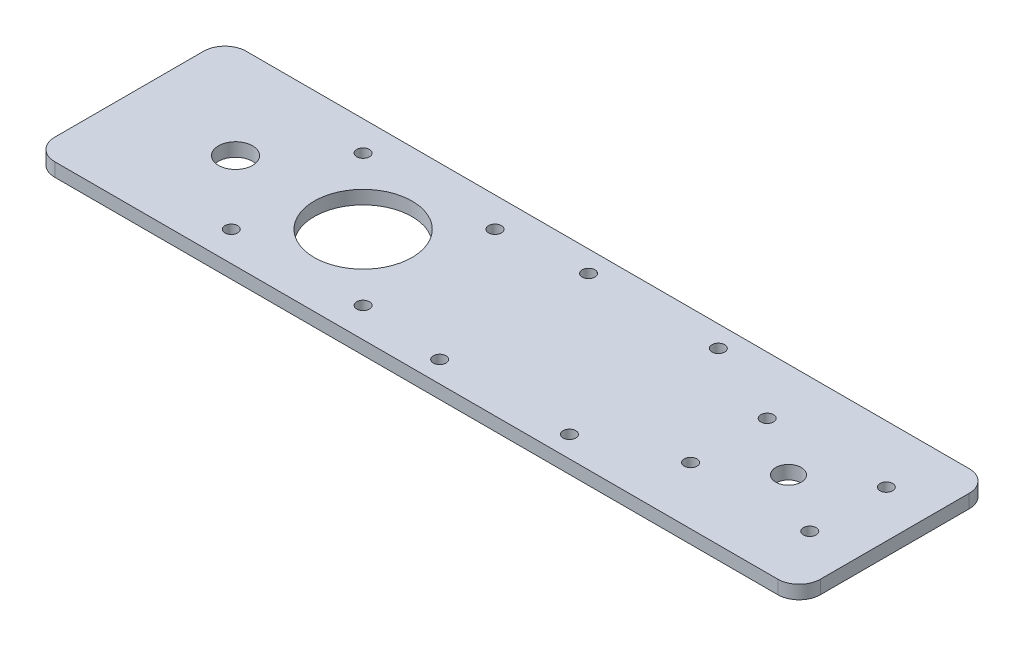
from build123d import *

# Parameters (mm, degrees)
SKETCH1_W           = 180
SKETCH1_H           = 45
BOSS_EXTRUDE1_DEPTH = 3.175
FILLET1_R           = 5
SKETCH4_R           = 3
SKETCH4_R_2         = 1.5
CUT_EXTRUDE1_DEPTH  = 157.65672863
SKETCH5_R           = 4
CUT_EXTRUDE2_DEPTH  = 157.65672863
SKETCH6_R           = 1.5
SKETCH6_R_2         = 11.5
CUT_EXTRUDE3_DEPTH  = 157.65672863
SKETCH10_R          = 1.5
CUT_EXTRUDE4_DEPTH  = 157.65672863


with BuildPart() as part:
    # Sketch1 → Boss-Extrude1 (new body)
    with BuildSketch(Plane(origin=(0, 0, 0), x_dir=(1, 0, 0), z_dir=(0, 1, 0))):
        with Locations((65, 0)):
            Rectangle(SKETCH1_W, SKETCH1_H)
    extrude(amount=BOSS_EXTRUDE1_DEPTH)

    # Fillet1
    fillet1_edges = [part.edges().sort_by_distance(p)[0] for p in [
        (-25, 1.5875, -22.5),
        (155, 1.5875, -22.5),
        (155, 1.5875, 22.5),
        (-25, 1.5875, 22.5),
    ]]
    fillet(fillet1_edges, radius=FILLET1_R)

    # Sketch4 → Cut-Extrude1 (cut, through all)
    with BuildSketch(Plane(origin=(0, 3.175, 0), x_dir=(1, 0, 0), z_dir=(0, 1, 0))):
        with Locations(Location((130, 0, 0), (0, 0, 270))):
            Circle(SKETCH4_R)
        with Locations(Location((116, 9, 0), (0, 0, 270))):
            Circle(SKETCH4_R_2)
        with Locations(Location((144, 9, 0), (0, 0, 90))):
            Circle(SKETCH4_R_2)
        with Locations(Location((144, -9, 0), (0, 0, 270))):
            Circle(SKETCH4_R_2)
        with Locations(Location((116, -9, 0), (0, 0, 90))):
            Circle(SKETCH4_R_2)
    extrude(amount=-CUT_EXTRUDE1_DEPTH, mode=Mode.SUBTRACT)

    # Sketch5 → Cut-Extrude2 (cut, through all)
    with BuildSketch(Plane(origin=(0, 3.175, 0), x_dir=(1, 0, 0), z_dir=(0, 1, 0))):
        with Locations(Location((0, 0, 0), (0, 0, 270))):
            Circle(SKETCH5_R)
    extrude(amount=-CUT_EXTRUDE2_DEPTH, mode=Mode.SUBTRACT)

    # Sketch6 → Cut-Extrude3 (cut, through all)
    with BuildSketch(Plane(origin=(0, 3.175, 0), x_dir=(1, 0, 0), z_dir=(0, 1, 0))):
        with Locations(Location((14.5, -15.5, 0), (0, 0, 270))):
            Circle(SKETCH6_R)
        with Locations(Location((14.5, 15.5, 0), (0, 0, 90))):
            Circle(SKETCH6_R)
        with Locations(Location((45.5, 15.5, 0), (0, 0, 270))):
            Circle(SKETCH6_R)
        with Locations(Location((45.5, -15.5, 0), (0, 0, 90))):
            Circle(SKETCH6_R)
        with Locations(Location((30, 0, 0), (0, 0, 270))):
            Circle(SKETCH6_R_2)
    extrude(amount=-CUT_EXTRUDE3_DEPTH, mode=Mode.SUBTRACT)

    # Sketch10 → Cut-Extrude4 (cut, through all)
    with BuildSketch(Plane(origin=(0, 3.175, 0), x_dir=(1, 0, 0), z_dir=(0, 1, 0))):
        with Locations(Location((65.5, -17.5, 0), (0, 0, 270))):
            Circle(SKETCH10_R)
        with Locations(Location((96, -17.5, 0), (0, 0, 270))):
            Circle(SKETCH10_R)
        with Locations(Location((96, 17.5, 0), (0, 0, 90))):
            Circle(SKETCH10_R)
        with Locations(Location((65.5, 17.5, 0), (0, 0, 90))):
            Circle(SKETCH10_R)
    extrude(amount=-CUT_EXTRUDE4_DEPTH, mode=Mode.SUBTRACT)


solid = part.part
